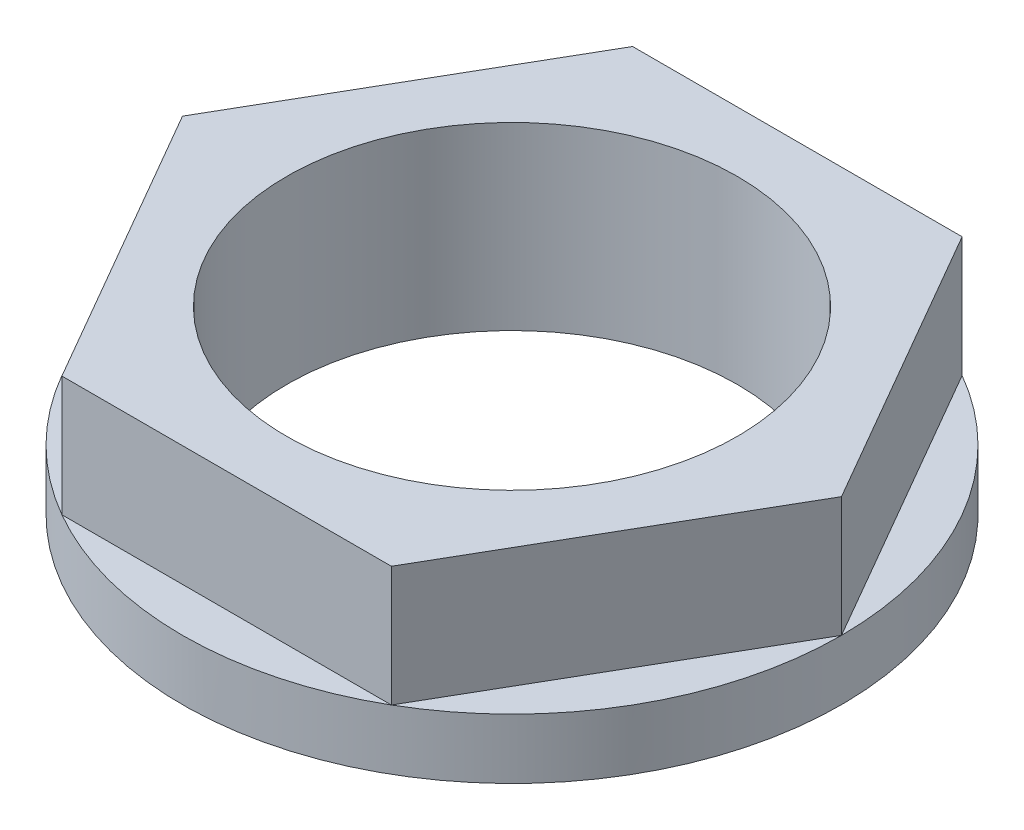
from build123d import *

# Parameters (mm, degrees)
EXTRUDE_1_DEPTH     = 4
SKETCH_3_R          = 10.969655115
EXTRUDE_2_DEPTH     = 2
SKETCH_4_R          = 7.5
CUT_EXTRUDE_1_DEPTH = 17.633299933


with BuildPart() as part:
    # Эскиз1 → Вытянуть1 (new body)
    with BuildSketch(Plane(origin=(0, 0, 0), x_dir=(1, 0, 0), z_dir=(0, 1, 0))):
        Polygon((-5.484827557, 9.5), (5.484827557, 9.5), (10.969655115, 0), (5.484827557, -9.5), (-5.484827557, -9.5), (-10.969655115, 0), align=None)
    extrude(amount=EXTRUDE_1_DEPTH)

    # Эскиз3 → Вытянуть2 (add)
    with BuildSketch(Plane.XZ):
        Circle(SKETCH_3_R)
    extrude(amount=EXTRUDE_2_DEPTH)

    # Эскиз4 → Вырез-Вытянуть1 (cut, through all)
    with BuildSketch(Plane.XZ.offset(2)):
        Circle(SKETCH_4_R)
    extrude(amount=-CUT_EXTRUDE_1_DEPTH, mode=Mode.SUBTRACT)


solid = part.part
